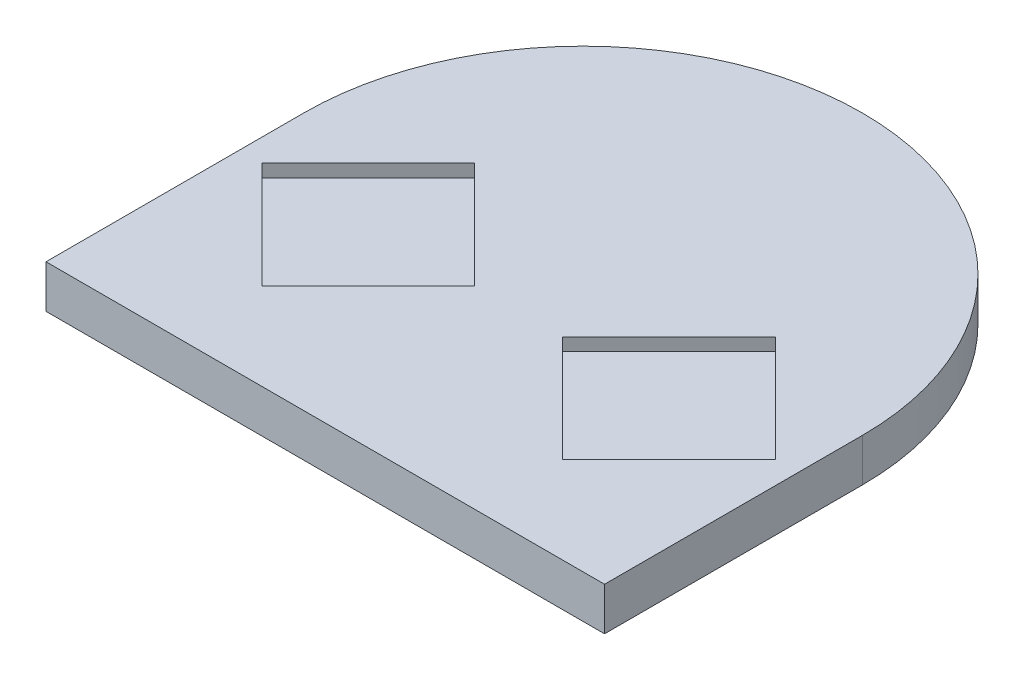
from build123d import *

# Parameters (mm, degrees)
EXTRUDE_1_DEPTH     = 10
CUT_EXTRUDE_1_DEPTH = 3


with BuildPart() as part:
    # 草图1 → 凸台-拉伸1 (new body)
    with BuildSketch(Plane(origin=(0, 0, 0), x_dir=(1, 0, 0), z_dir=(0, 1, 0))):
        with BuildLine():
            Line((0, 0), (0, -60))
            Line((0, -60), (130, -60))
            Line((130, -60), (130, 0))
            ThreePointArc((130, 0), (65, 65), (0, 0))
        make_face()
    extrude(amount=EXTRUDE_1_DEPTH)

    # 草图2 → 切除-拉伸1 (cut)
    with BuildSketch(Plane(origin=(0, 10, 0), x_dir=(1, 0, 0), z_dir=(0, 1, 0))):
        Polygon((5.251262658, -15), (30, -39.748737342), (54.748737342, -15), (30, 9.748737342), align=None)
        Polygon((100, 9.748737342), (75.251262658, -15), (100, -39.748737342), (124.748737342, -15), align=None)
    extrude(amount=-CUT_EXTRUDE_1_DEPTH, mode=Mode.SUBTRACT)


solid = part.part
